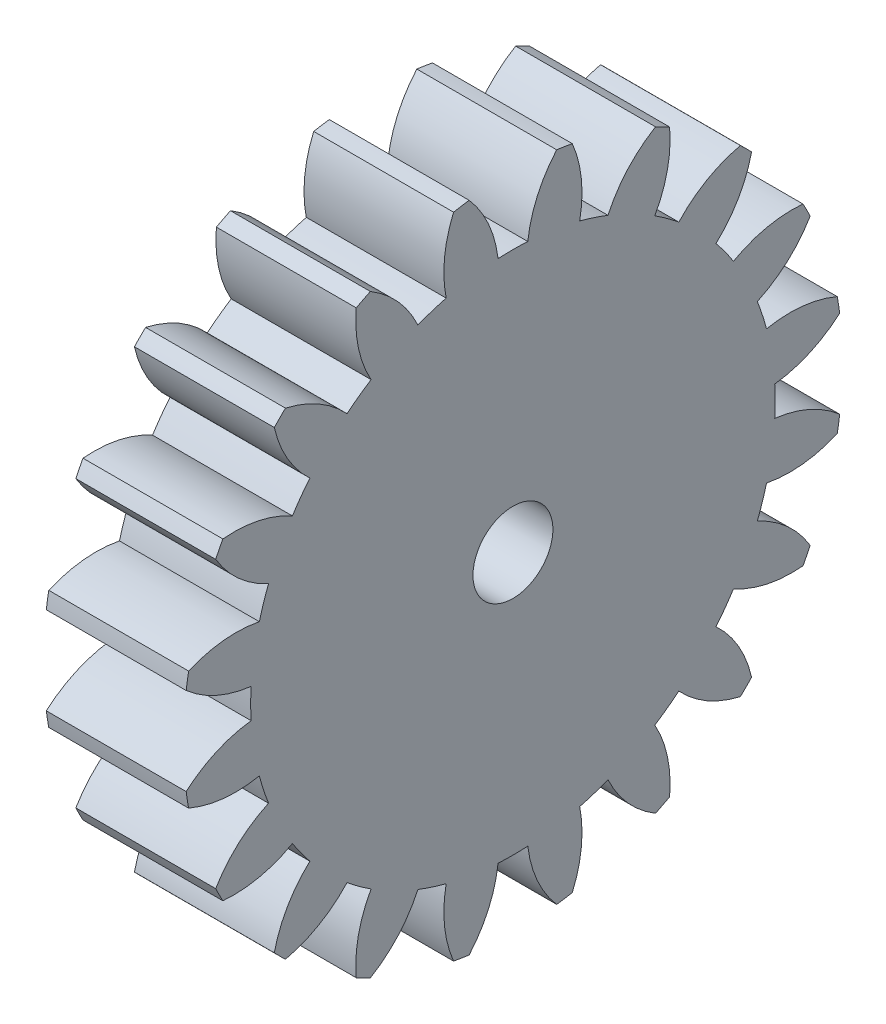
from build123d import *

# Parameters (mm, degrees)
BASPROSKE_W     = 7
BASPROSKE_H     = 16.5
TOOTHCUT_DEPTH  = 25.36185543
TEETHCUTS_COUNT = 20
TEETHCUTS_ANGLE = 342
BORSKE_R        = 2
BORE_DEPTH      = 50.0000508


with BuildPart() as part:
    # BasProSke → Base-Revolve (revolve)
    with BuildSketch(Plane(origin=(0, 0, 0), x_dir=(1, 0, 0), z_dir=(0, 1, 0)), mode=Mode.PRIVATE) as base_revolve_sk:
        with Locations((3.5, 8.25)):
            Rectangle(BASPROSKE_W, BASPROSKE_H)
    revolve(base_revolve_sk.sketch.rotate(Axis((-10, 0, 0), (1, 0, 0)), 180), axis=Axis((-10, 0, 0), (1, 0, 0)))

    # TooCutSke → ToothCut (cut, through all)
    with BuildSketch(Plane(origin=(0, 0, 0), x_dir=(0, 0, -1), z_dir=(1, 0, 0))):
        with BuildLine():
            ThreePointArc((0.74381438, 13.102904875), (0, 13.124), (-0.74381438, 13.102904875))
            ThreePointArc((-0.74381438, 13.102904875), (-1.226473103, 14.852072512), (-2.209965745, 16.376962373))
            ThreePointArc((-2.209965745, 16.376962373), (0, 16.5254), (2.209965745, 16.376962373))
            ThreePointArc((2.209965745, 16.376962373), (1.226473103, 14.852072512), (0.74381438, 13.102904875))
        make_face()
    toothcut = extrude(amount=TOOTHCUT_DEPTH, mode=Mode.SUBTRACT)

    # TeethCuts: ToothCut ×20 about axis
    teethcuts_axis = Axis((-10, 0, 0), (1, 0, 0))
    for i in range(1, TEETHCUTS_COUNT):
        add(toothcut.rotate(teethcuts_axis, i * TEETHCUTS_ANGLE / (TEETHCUTS_COUNT - 1)), mode=Mode.SUBTRACT)

    # BorSke → Bore (cut, symmetric)
    with BuildSketch(Plane(origin=(0, 0, 0), x_dir=(0, 0, -1), z_dir=(1, 0, 0))):
        with Locations(Location((0, 0, 0), (0, 0, 180))):
            Circle(BORSKE_R)
    extrude(amount=BORE_DEPTH, both=True, mode=Mode.SUBTRACT)


solid = part.part
